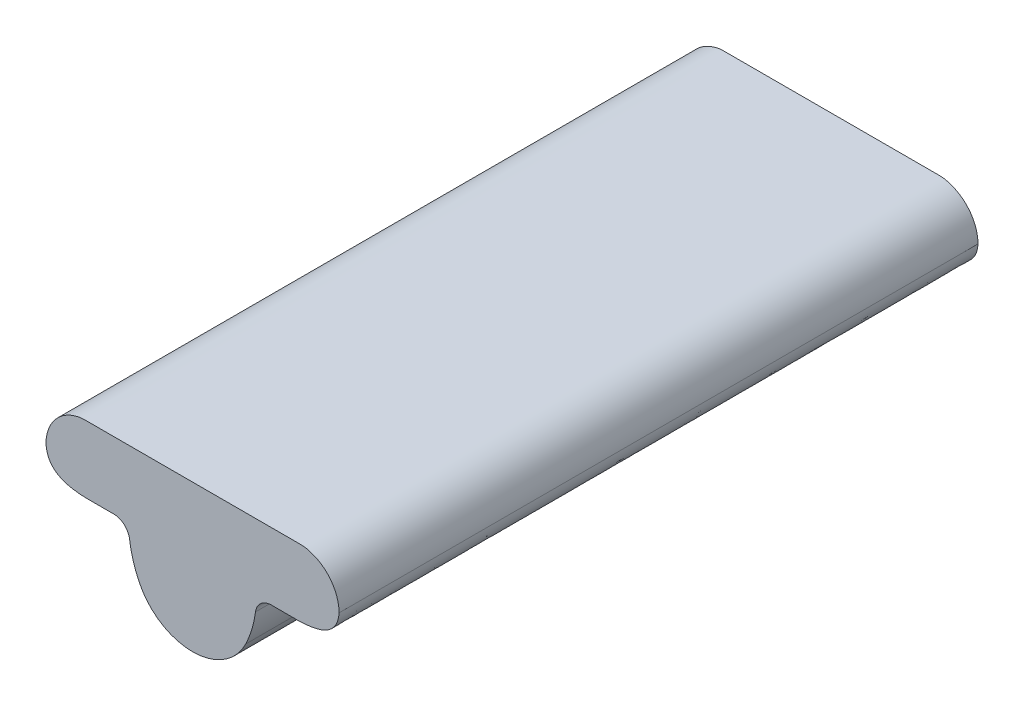
from build123d import *

# Parameters (mm, degrees)
BOSS_EXTRUDE1_DEPTH = 6


with BuildPart() as part:
    # Sketch1 → Boss-Extrude1 (new body)
    with BuildSketch(Plane.XY):
        with BuildLine():
            Line((-1, -0.254), (-0.740175425, -0.254))
            ThreePointArc((-0.740175425, -0.254), (-0.641268354, -0.291228588), (-0.591456891, -0.384434783))
            ThreePointArc((-0.591456891, -0.384434783), (-0.557611714, -0.542062154), (-0.498876404, -0.692202247))
            ThreePointArc((-0.498876404, -0.692202247), (0, -1.004), (0.498876404, -0.692202247))
            ThreePointArc((0.498876404, -0.692202247), (0.557611714, -0.542062154), (0.591456891, -0.384434783))
            ThreePointArc((0.591456891, -0.384434783), (0.641268354, -0.291228588), (0.740175425, -0.254))
            Line((0.740175425, -0.254), (1, -0.254))
            add(Edge.make_bspline(
                [(1.376, 0), (1.362302216, -0.221622552), (1.151418555, -0.248602833), (1, -0.254)],
                knots=[0, 0, 0, 0, 1, 1, 1, 1], degree=3))
            add(Edge.make_bspline(
                [(-1.376, 0), (-1.376, 0.156890105), (-1.288836528, 0.28733946), (-1.143888971, 0.347378704), (-1.128828921, 0.353616781), (-1.097897496, 0.364134221), (-1.048902641, 0.376), (-1.01630088, 0.376), (-1, 0.376), (-0.98369912, 0.376), (-0.951097359, 0.376), (-0.902194719, 0.376), (-0.869592958, 0.376), (-0.853292078, 0.376), (-0.284430693, 0.376), (0.284430693, 0.376), (0.853292078, 0.376), (0.869592958, 0.376), (0.902194719, 0.376), (0.951097359, 0.376), (0.98369912, 0.376), (1, 0.376), (1.01630088, 0.376), (1.048902641, 0.376), (1.097897496, 0.364134221), (1.128828921, 0.353616781), (1.143888971, 0.347378704), (1.288836528, 0.28733946), (1.376, 0.156890105), (1.376, 0)],
                knots=[0, 0, 0, 0, 0.133521792, 0.133521792, 0.133521792, 0.149150664, 0.164779537, 0.18040841, 0.18040841, 0.18040841, 0.196037283, 0.211666155, 0.227295028, 0.227295028, 0.227295028, 0.772704972, 0.772704972, 0.772704972, 0.788333845, 0.803962717, 0.81959159, 0.81959159, 0.81959159, 0.835220463, 0.850849336, 0.866478208, 0.866478208, 0.866478208, 1, 1, 1, 1], degree=3, weights=[1, 0.887646408, 0.887646408, 1, 1, 1, 1, 1, 1, 1, 1, 1, 1, 1, 1, 1, 1, 1, 1, 1, 1, 1, 1, 1, 1, 1, 1, 0.887646408, 0.887646408, 1]))
            add(Edge.make_bspline(
                [(-1.376, 0), (-1.362302216, -0.221622552), (-1.151418555, -0.248602833), (-1, -0.254)],
                knots=[0, 0, 0, 0, 1, 1, 1, 1], degree=3))
        make_face()
    extrude(amount=BOSS_EXTRUDE1_DEPTH)


solid = part.part
